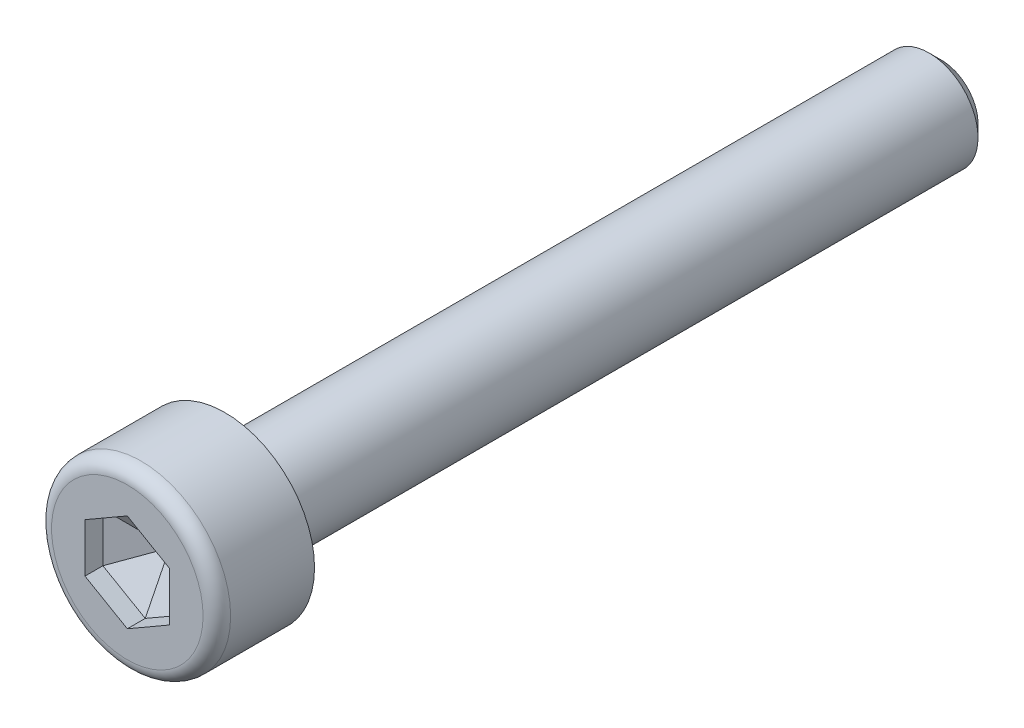
from build123d import *
from OCP.BRepFilletAPI import BRepFilletAPI_MakeChamfer

# Parameters (mm, degrees)
SKETCH_1_R          = 2.75
EXTRUDE_1_DEPTH     = 3
CUT_EXTRUDE_1_DEPTH = 1.3
SKETCH_3_R          = 1.5
EXTRUDE_2_DEPTH     = 22
CHAMFER_1_SIZE      = 0.375
FILLET_1_R          = 0.423076923
CHAMFER_2_SIZE      = 0.749279539
CHAMFER_2_SIZE2     = 1.29779023
FILLET_2_R          = 0.1


with BuildPart() as part:
    # 草图1 → 凸台-拉伸1 (new body)
    with BuildSketch(Plane.XY):
        Circle(SKETCH_1_R)
    extrude(amount=EXTRUDE_1_DEPTH)

    # 草图2 → 切除-拉伸1 (cut)
    with BuildSketch(Plane.XY.offset(3)):
        Polygon((1.3, 0.75055535), (0, 1.5011107), (-1.3, 0.75055535), (-1.3, -0.75055535), (0, -1.5011107), (1.3, -0.75055535), align=None)
    extrude(amount=-CUT_EXTRUDE_1_DEPTH, mode=Mode.SUBTRACT)

    # 草图3 → 凸台-拉伸2 (add)
    with BuildSketch(Plane(origin=(0, 0, 0), x_dir=(-1, 0, 0), z_dir=(0, 0, -1))):
        Circle(SKETCH_3_R)
    extrude(amount=EXTRUDE_2_DEPTH)

    # 倒角1
    chamfer_1_edges = [part.edges().sort_by_distance(p)[0] for p in [
        (1.5, 0, -22),
    ]]
    chamfer(chamfer_1_edges, length=CHAMFER_1_SIZE)

    # 圆角1
    fillet_1_edges = [part.edges().sort_by_distance(p)[0] for p in [
        (-2.75, 0, 3),
    ]]
    fillet(fillet_1_edges, radius=FILLET_1_R)

    # 倒角2: one chamfer whose edges measure the first distance from different faces: ONE call of the kernel's chamfer builder (chamfer() names one face for all edges)
    chamfer_2_edges_1 = [part.edges().sort_by_distance(p)[0] for p in [
        (-1.3, 0, 1.7),
    ]]
    chamfer_2_side_1 = [part.faces().sort_by_distance(p)[0] for p in [
        (-1.3, 0, 2.35),
    ]]
    chamfer_2_edges_2 = [part.edges().sort_by_distance(p)[0] for p in [
        (-0.65, 1.125833025, 1.7),
    ]]
    chamfer_2_side_2 = [part.faces().sort_by_distance(p)[0] for p in [
        (-0.65, 1.125833025, 2.35),
    ]]
    chamfer_2_edges_3 = [part.edges().sort_by_distance(p)[0] for p in [
        (0.65, 1.125833025, 1.7),
    ]]
    chamfer_2_side_3 = [part.faces().sort_by_distance(p)[0] for p in [
        (0.65, 1.125833025, 2.35),
    ]]
    chamfer_2_edges_4 = [part.edges().sort_by_distance(p)[0] for p in [
        (1.3, 0, 1.7),
    ]]
    chamfer_2_side_4 = [part.faces().sort_by_distance(p)[0] for p in [
        (1.3, 0, 2.35),
    ]]
    chamfer_2_edges_5 = [part.edges().sort_by_distance(p)[0] for p in [
        (-0.65, -1.125833025, 1.7),
    ]]
    chamfer_2_side_5 = [part.faces().sort_by_distance(p)[0] for p in [
        (-0.65, -1.125833025, 2.35),
    ]]
    chamfer_2_edges_6 = [part.edges().sort_by_distance(p)[0] for p in [
        (0.65, -1.125833025, 1.7),
    ]]
    chamfer_2_side_6 = [part.faces().sort_by_distance(p)[0] for p in [
        (0.65, -1.125833025, 2.35),
    ]]
    chamfer_2 = BRepFilletAPI_MakeChamfer(part.part.solid().wrapped)
    for e in chamfer_2_edges_1:
        chamfer_2.Add(CHAMFER_2_SIZE, CHAMFER_2_SIZE2, e.wrapped, chamfer_2_side_1[0].wrapped)  # the first distance lies on this face
    for e in chamfer_2_edges_2:
        chamfer_2.Add(CHAMFER_2_SIZE, CHAMFER_2_SIZE2, e.wrapped, chamfer_2_side_2[0].wrapped)  # the first distance lies on this face
    for e in chamfer_2_edges_3:
        chamfer_2.Add(CHAMFER_2_SIZE, CHAMFER_2_SIZE2, e.wrapped, chamfer_2_side_3[0].wrapped)  # the first distance lies on this face
    for e in chamfer_2_edges_4:
        chamfer_2.Add(CHAMFER_2_SIZE, CHAMFER_2_SIZE2, e.wrapped, chamfer_2_side_4[0].wrapped)  # the first distance lies on this face
    for e in chamfer_2_edges_5:
        chamfer_2.Add(CHAMFER_2_SIZE, CHAMFER_2_SIZE2, e.wrapped, chamfer_2_side_5[0].wrapped)  # the first distance lies on this face
    for e in chamfer_2_edges_6:
        chamfer_2.Add(CHAMFER_2_SIZE, CHAMFER_2_SIZE2, e.wrapped, chamfer_2_side_6[0].wrapped)  # the first distance lies on this face
    add(Compound.cast(chamfer_2.Shape()), mode=Mode.REPLACE)

    # 圆角2
    fillet_2_edges = [part.edges().sort_by_distance(p)[0] for p in [
        (1.5, 0, 0),
    ]]
    fillet(fillet_2_edges, radius=FILLET_2_R)


solid = part.part
